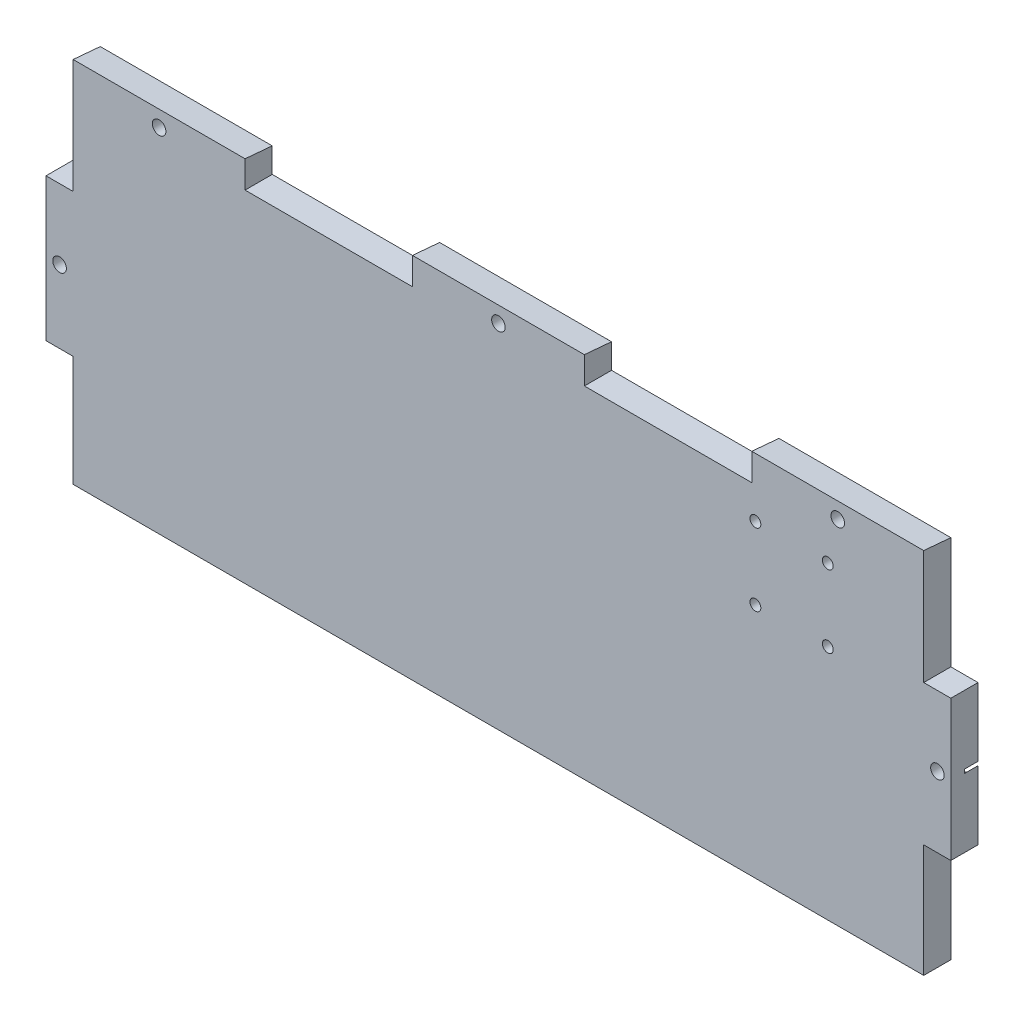
from build123d import *

# Parameters (mm, degrees)
ESQUISSE1_W                  = 188
ESQUISSE1_H                  = 81.33
BOSS_EXTRU_1_DEPTH           = 6
ENL_V_MAT_EXTRU_2_DEPTH      = 205.925764364
ENL_V_MAT_EXTRU_2_DEPTH_BACK = 205.925764364
ESQUISSE4_W                  = 6
ESQUISSE4_H                  = 31.567534009
BOSS_EXTRU_2_DEPTH           = 6
ESQUISSE5_W                  = 6
ESQUISSE5_H                  = 31.067534009
BOSS_EXTRU_3_DEPTH           = 6
ESQUISSE6_W                  = 37
ESQUISSE6_H                  = 6
ENL_V_MAT_EXTRU_3_DEPTH      = 6
ESQUISSE7_R                  = 2.995
ENL_V_MAT_EXTRU_4_DEPTH      = 3
ESQUISSE8_R                  = 1.5
ENL_V_MAT_EXTRU_5_DEPTH      = 6
ESQUISSE9_R                  = 1.2
ENL_V_MAT_EXTRU_6_DEPTH      = 10


with BuildPart() as part:
    # Esquisse1 → Boss.-Extru.1 (new body)
    with BuildSketch(Plane.XY):
        with Locations((-94, 40.665)):
            Rectangle(ESQUISSE1_W, ESQUISSE1_H)
    extrude(amount=BOSS_EXTRU_1_DEPTH)

    # Esquisse2 → Enlèv. mat.-Extru.2 (cut, two sides: drawn at the far end of the back side and taken through both)
    with BuildSketch(Plane.ZY.offset(188).offset(-ENL_V_MAT_EXTRU_2_DEPTH_BACK)):
        Polygon((178.443334928, 96.416836907), (6, 81.33), (0, 80.805068019), (-172.443334928, 65.718231112), (-202.617008742, 410.604900969), (148.269661115, 441.303506764), align=None)
    extrude(amount=ENL_V_MAT_EXTRU_2_DEPTH + ENL_V_MAT_EXTRU_2_DEPTH_BACK, mode=Mode.SUBTRACT)

    # Esquisse4 → Boss.-Extru.2 (add)
    with BuildSketch(Plane.ZY.offset(188)):
        with Locations((3, 40.283767005)):
            Rectangle(ESQUISSE4_W, ESQUISSE4_H)
    extrude(amount=BOSS_EXTRU_2_DEPTH)

    # Esquisse5 → Boss.-Extru.3 (add)
    with BuildSketch(Plane(origin=(0, 0, 0), x_dir=(0, 0, -1), z_dir=(1, 0, 0))):
        with Locations((-3, 40.533767005)):
            Rectangle(ESQUISSE5_W, ESQUISSE5_H)
    extrude(amount=BOSS_EXTRU_3_DEPTH)

    # Esquisse6 → Enlèv. mat.-Extru.3 (cut)
    with BuildSketch(Plane.XY.offset(6)):
        with Locations((-131.5, 78.33)):
            Rectangle(ESQUISSE6_W, ESQUISSE6_H)
        with Locations((-56.5, 78.33)):
            Rectangle(ESQUISSE6_W, ESQUISSE6_H)
    extrude(amount=-ENL_V_MAT_EXTRU_3_DEPTH, mode=Mode.SUBTRACT)

    # Esquisse7 → Enlèv. mat.-Extru.4 (cut)
    with BuildSketch(Plane(origin=(0, 0, 0), x_dir=(-1, 0, 0), z_dir=(0, 0, -1))):
        with Locations((94, 77.805068019)):
            Circle(ESQUISSE7_R)
        with Locations((19, 77.805068019)):
            Circle(ESQUISSE7_R)
        with Locations((169, 77.805068019)):
            Circle(ESQUISSE7_R)
        with Locations((191, 40.567534009)):
            Circle(ESQUISSE7_R)
        with Locations((-3.034014412, 40.567534009)):
            Circle(ESQUISSE7_R)
    extrude(amount=-ENL_V_MAT_EXTRU_4_DEPTH, mode=Mode.SUBTRACT)

    # Esquisse8 → Enlèv. mat.-Extru.5 (cut)
    with BuildSketch(Plane(origin=(0, 0, 0), x_dir=(-1, 0, 0), z_dir=(0, 0, -1))):
        with Locations((-3.034014412, 40.567534009)):
            Circle(ESQUISSE8_R)
        with Locations((19, 77.805068019)):
            Circle(ESQUISSE8_R)
        with Locations((94, 77.805068019)):
            Circle(ESQUISSE8_R)
        with Locations((169, 77.805068019)):
            Circle(ESQUISSE8_R)
        with Locations((191, 40.567534009)):
            Circle(ESQUISSE8_R)
    extrude(amount=-ENL_V_MAT_EXTRU_5_DEPTH, mode=Mode.SUBTRACT)

    # Esquisse9 → Enlèv. mat.-Extru.6 (cut)
    with BuildSketch(Plane.XY.offset(6)):
        with Locations((-21.2, 68.33)):
            Circle(ESQUISSE9_R)
        with Locations((-21.2, 52.33)):
            Circle(ESQUISSE9_R)
        with Locations((-37.2, 68.33)):
            Circle(ESQUISSE9_R)
        with Locations((-37.2, 52.33)):
            Circle(ESQUISSE9_R)
    extrude(amount=-ENL_V_MAT_EXTRU_6_DEPTH, mode=Mode.SUBTRACT)


solid = part.part
